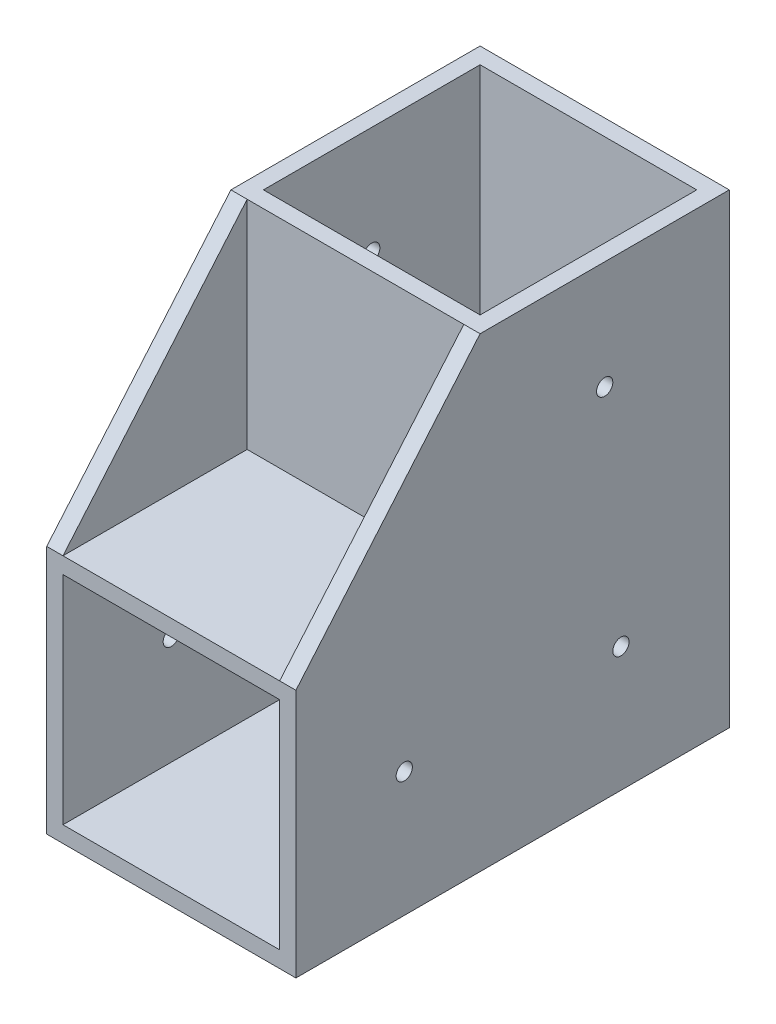
from build123d import *

# Parameters (mm, degrees)
ESQUISSE1_W             = 46
ESQUISSE1_H             = 46
ESQUISSE1_W_2           = 40
ESQUISSE1_H_2           = 40
BOSS_EXTRU_1_DEPTH      = 80
ESQUISSE2_W             = 46
ESQUISSE2_H             = 46
ESQUISSE2_W_2           = 40
ESQUISSE2_H_2           = 40
BOSS_EXTRU_2_DEPTH      = 40
BOSS_EXTRU_3_DEPTH      = 3
BOSS_EXTRU_4_DEPTH      = 3
ESQUISSE5_R             = 1.5
ENL_V_MAT_EXTRU_1_DEPTH = 104.111590037


with BuildPart() as part:
    # Esquisse1 → Boss.-Extru.1 (new body)
    with BuildSketch(Plane.XY):
        with Locations((23, -23)):
            Rectangle(ESQUISSE1_W, ESQUISSE1_H)
        with Locations((23, -23)):
            Rectangle(ESQUISSE1_W_2, ESQUISSE1_H_2, mode=Mode.SUBTRACT)
    extrude(amount=BOSS_EXTRU_1_DEPTH)

    # Esquisse2 → Boss.-Extru.2 (add)
    with BuildSketch(Plane(origin=(0, 0, 0), x_dir=(1, 0, 0), z_dir=(0, 1, 0))):
        with Locations((23, -23)):
            Rectangle(ESQUISSE2_W, ESQUISSE2_H)
        with Locations((23, -23)):
            Rectangle(ESQUISSE2_W_2, ESQUISSE2_H_2, mode=Mode.SUBTRACT)
    extrude(amount=BOSS_EXTRU_2_DEPTH)

    # Esquisse3 → Boss.-Extru.3 (add)
    with BuildSketch(Plane(origin=(46, 0, 0), x_dir=(0, 0, -1), z_dir=(1, 0, 0))):
        Polygon((-80, 0), (-46, 40), (-46, 0), align=None)
    extrude(amount=-BOSS_EXTRU_3_DEPTH)

    # Esquisse4 → Boss.-Extru.4 (add)
    with BuildSketch(Plane.ZY):
        Polygon((46, 40), (80, 0), (46, 0), align=None)
    extrude(amount=-BOSS_EXTRU_4_DEPTH)

    # Esquisse5 → Enlèv. mat.-Extru.1 (cut, through all)
    with BuildSketch(Plane.ZY):
        with Locations(Location((23, 20, 0), (0, 0, 270))):
            Circle(ESQUISSE5_R)
        with Locations(Location((20, -23, 0), (0, 0, 270))):
            Circle(ESQUISSE5_R)
        with Locations(Location((60, -23, 0), (0, 0, 270))):
            Circle(ESQUISSE5_R)
    extrude(amount=-ENL_V_MAT_EXTRU_1_DEPTH, mode=Mode.SUBTRACT)


solid = part.part
